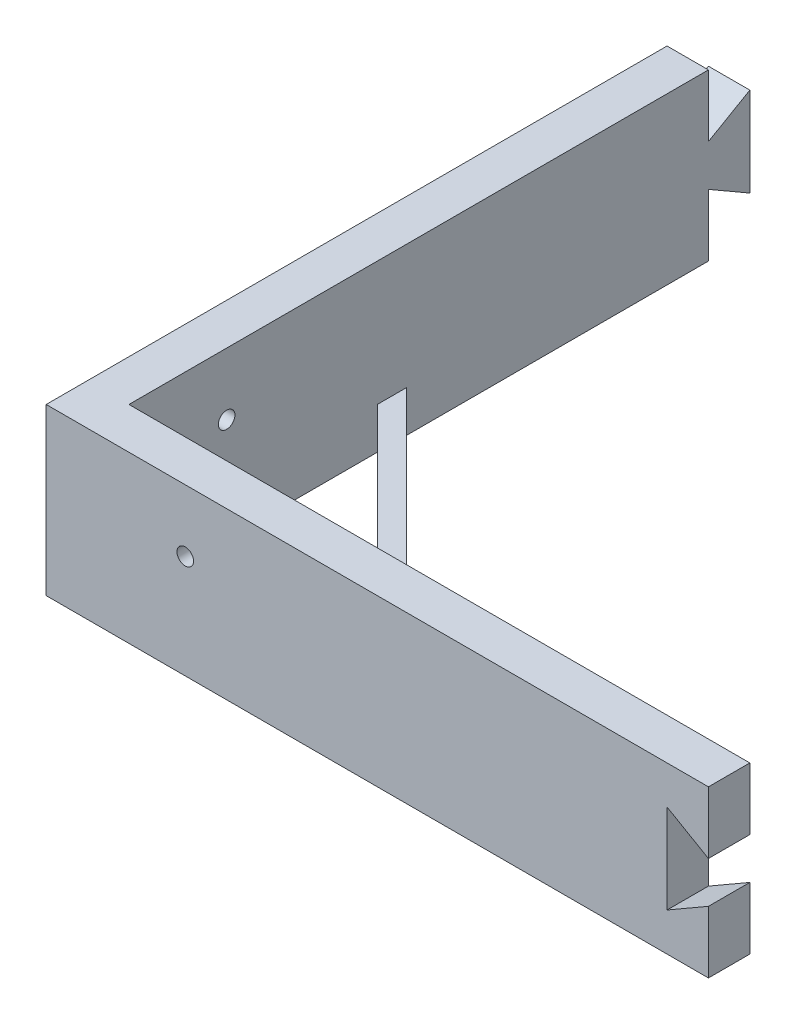
from build123d import *

# Parameters (mm, degrees)
SKETCH1_W           = 12.7
SKETCH1_H           = 50.8
BOSS_EXTRUDE1_DEPTH = 203.2
SKETCH2_W           = 12.7
SKETCH2_H           = 50.8
BOSS_EXTRUDE2_DEPTH = 190.5
BOSS_EXTRUDE5_DEPTH = 12.7
CUT_EXTRUDE2_DEPTH  = 285.051619429
CUT_EXTRUDE3_DEPTH  = 280.688487428
SKETCH9_R           = 2.54
CUT_EXTRUDE4_DEPTH  = 276.109673585
SKETCH10_R          = 2.54
CUT_EXTRUDE5_DEPTH  = 280.688487428


with BuildPart() as part:
    # Sketch1 → Boss-Extrude1 (new body)
    with BuildSketch(Plane.XY):
        Rectangle(SKETCH1_W, SKETCH1_H)
    extrude(amount=BOSS_EXTRUDE1_DEPTH)

    # Sketch2 → Boss-Extrude2 (add)
    with BuildSketch(Plane(origin=(6.35, 0, 0), x_dir=(0, 0, -1), z_dir=(1, 0, 0))):
        with Locations((-196.85, 0)):
            Rectangle(SKETCH2_W, SKETCH2_H)
    extrude(amount=BOSS_EXTRUDE2_DEPTH)

    # Sketch6 → Boss-Extrude5 (add)
    with BuildSketch(Plane.XZ.offset(25.4)):
        Polygon((6.35, 114.3), (6.35, 105.319743879), (91.530256121, 190.5), (82.55, 190.5), align=None)
    extrude(amount=-BOSS_EXTRUDE5_DEPTH)

    # Sketch7 → Cut-Extrude2 (cut, through all)
    with BuildSketch(Plane.XY.offset(203.2)):
        Polygon((196.85, 3.666174209), (196.85, 6.35), (184.15, 13.682348419), (184.15, 0), (196.85, 0), align=None)
        Polygon((196.85, 0), (184.15, 0), (184.15, -3.666174209), (184.15, -13.682348419), (196.85, -6.35), align=None)
    extrude(amount=-CUT_EXTRUDE2_DEPTH, mode=Mode.SUBTRACT)

    # Sketch8 → Cut-Extrude3 (cut, through all)
    with BuildSketch(Plane(origin=(6.35, 0, 0), x_dir=(0, 0, -1), z_dir=(1, 0, 0))):
        Polygon((-12.7, 6.35), (0, 13.682348419), (0, 25.4), (-12.7, 25.4), align=None)
        Polygon((0, -25.4), (0, -13.682348419), (-12.7, -6.35), (-12.7, -25.4), align=None)
    extrude(amount=-CUT_EXTRUDE3_DEPTH, mode=Mode.SUBTRACT)

    # Sketch9 → Cut-Extrude4 (cut, through all)
    with BuildSketch(Plane(origin=(0, 0, 190.5), x_dir=(-1, 0, 0), z_dir=(0, 0, -1))):
        with Locations((-36.322, 6.35)):
            Circle(SKETCH9_R)
    extrude(amount=-CUT_EXTRUDE4_DEPTH, mode=Mode.SUBTRACT)

    # Sketch10 → Cut-Extrude5 (cut, through all)
    with BuildSketch(Plane(origin=(6.35, 0, 0), x_dir=(0, 0, -1), z_dir=(1, 0, 0))):
        with Locations(Location((-160.528, 6.35, 0), (0, 0, 90))):
            Circle(SKETCH10_R)
    extrude(amount=-CUT_EXTRUDE5_DEPTH, mode=Mode.SUBTRACT)


solid = part.part
